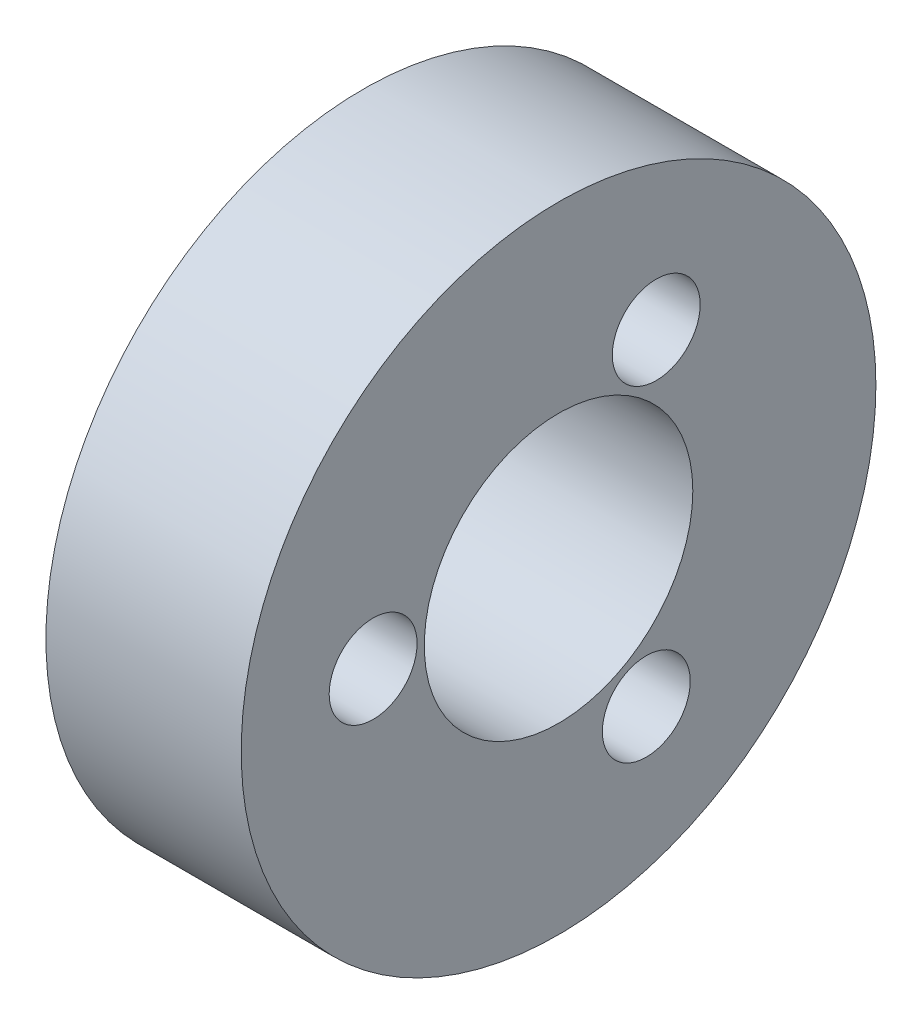
from build123d import *

# Parameters (mm, degrees)
SKETCH1_R           = 6.5
BOSS_EXTRUDE1_DEPTH = 4
SKETCH2_R           = 2.75
CUT_EXTRUDE1_DEPTH  = 7
SKETCH3_R           = 0.9
CUT_EXTRUDE2_DEPTH  = 7


with BuildPart() as part:
    # Sketch1 → Boss-Extrude1 (new body)
    with BuildSketch(Plane(origin=(0, 0, 0), x_dir=(0, 0, -1), z_dir=(1, 0, 0))):
        Circle(SKETCH1_R)
    extrude(amount=BOSS_EXTRUDE1_DEPTH)

    # Sketch2 → Cut-Extrude1 (cut)
    with BuildSketch(Plane(origin=(4, 0, 0), x_dir=(0, 0, -1), z_dir=(1, 0, 0))):
        Circle(SKETCH2_R)
    extrude(amount=-CUT_EXTRUDE1_DEPTH, mode=Mode.SUBTRACT)

    # Sketch3 → Cut-Extrude2 (cut)
    with BuildSketch(Plane.ZY):
        with Locations((-2.001020721, 3.230466851)):
            Circle(SKETCH3_R)
        with Locations((3.798176719, 0.117701352)):
            Circle(SKETCH3_R)
        with Locations((-1.797155999, -3.348168203)):
            Circle(SKETCH3_R)
    extrude(amount=-CUT_EXTRUDE2_DEPTH, mode=Mode.SUBTRACT)


solid = part.part
